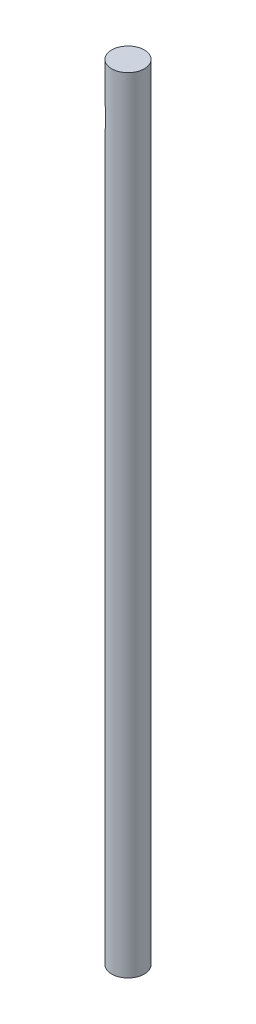
from build123d import *

# Parameters (mm, degrees)
SKETCH1_R           = 12.7
BOSS_EXTRUDE1_DEPTH = 609.6
SKETCH3_R           = 12.7
CUT_EXTRUDE1_DEPTH  = 6.35


with BuildPart() as part:
    # Sketch1 → Boss-Extrude1 (new body)
    with BuildSketch(Plane(origin=(0, 0, 0), x_dir=(1, 0, 0), z_dir=(0, 1, 0))):
        with Locations(Location((0, 0, 0), (0, 0, 90))):
            Circle(SKETCH1_R)
    extrude(amount=BOSS_EXTRUDE1_DEPTH)

    # Sketch3 → Cut-Extrude1 (cut)
    with BuildSketch(Plane.ZY.offset(12.7)):
        with Locations((0, 571.754)):
            Circle(SKETCH3_R)
    extrude(amount=-CUT_EXTRUDE1_DEPTH, mode=Mode.SUBTRACT)


solid = part.part
